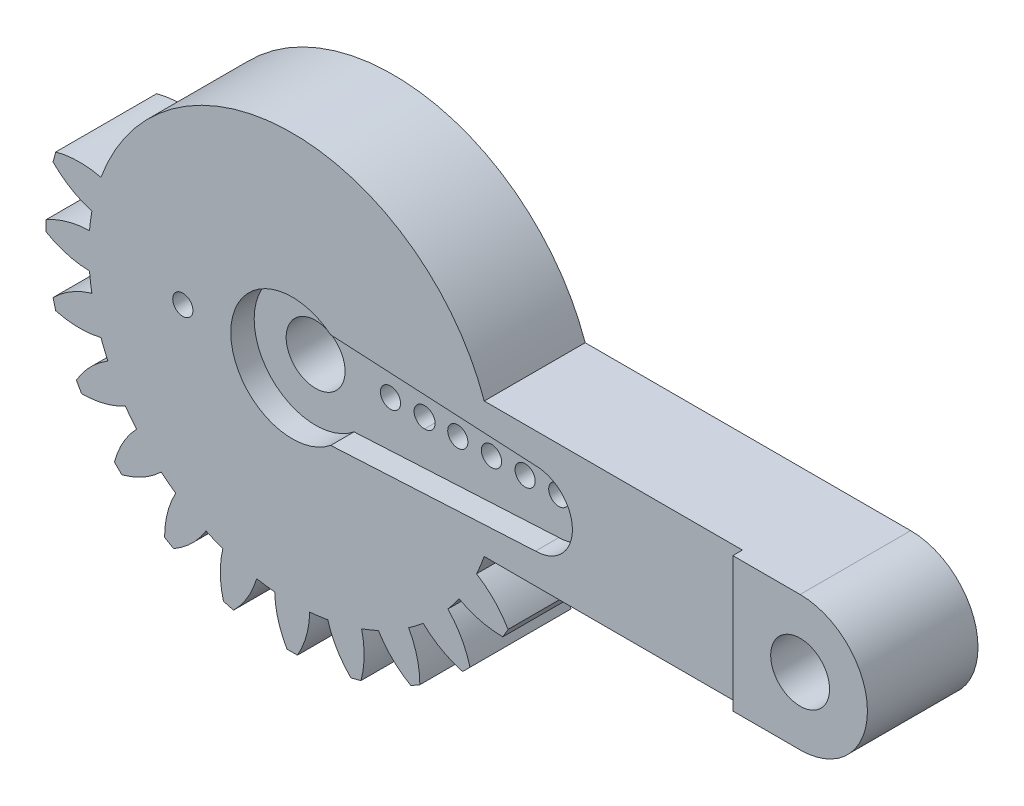
from build123d import *

# Parameters (mm, degrees)
SKETCH2_R           = 1.75
BOSS_EXTRUDE1_DEPTH = 10
SKETCH10_R          = 0.6
CUT_EXTRUDE1_DEPTH  = 40.007683858
CUT_EXTRUDE3_START  = -4
CUT_EXTRUDE3_DEPTH  = 4
BOSS_EXTRUDE2_START = 0.25
BOSS_EXTRUDE2_DEPTH = 0.25
SKETCH13_R          = 1.75
CUT_EXTRUDE11_DEPTH = 39.178520139
SKETCH28_R          = 0.6
CUT_EXTRUDE12_DEPTH = 39.178520139
CUT_EXTRUDE14_DEPTH = 1.39
BOSS_EXTRUDE3_START = 0.32
BOSS_EXTRUDE3_DEPTH = 0.32
SKETCH32_R          = 1.75
CUT_EXTRUDE18_DEPTH = 39.272239286


with BuildPart() as part:
    # Sketch2 → Boss-Extrude1 (new body)
    with BuildSketch(Plane.XY):
        with BuildLine():
            ThreePointArc((-11.365584201, 4.122086336), (-12.71070456, 4.273667417), (-14.051260935, 4.085959636))
            Line((-14.051260935, 4.085959636), (-14.211728743, 3.487085624))
            ThreePointArc((-14.211728743, 3.487085624), (-13.144626757, 2.65424773), (-11.903927815, 2.112960617))
            ThreePointArc((-11.903927815, 2.112960617), (-11.986568374, 1.578061664), (-12.04518576, 1.04))
            ThreePointArc((-12.04518576, 1.04), (-13.383704325, 0.838273314), (-14.63, 0.31))
            Line((-14.63, 0.31), (-14.63, -0.31))
            ThreePointArc((-14.63, -0.31), (-13.383704325, -0.838273314), (-12.04518576, -1.04))
            ThreePointArc((-12.04518576, -1.04), (-11.986568374, -1.578061664), (-11.903927815, -2.112960617))
            ThreePointArc((-11.903927815, -2.112960617), (-13.144626757, -2.65424773), (-14.211728743, -3.487085624))
            Line((-14.211728743, -3.487085624), (-14.051260935, -4.085959636))
            ThreePointArc((-14.051260935, -4.085959636), (-12.71070456, -4.273667417), (-11.365584201, -4.122086336))
            ThreePointArc((-11.365584201, -4.122086336), (-11.169703548, -4.626642697), (-10.951436862, -5.12192646))
            ThreePointArc((-10.951436862, -5.12192646), (-12.009764599, -5.965886177), (-12.824951657, -7.046532125))
            Line((-12.824951657, -7.046532125), (-12.514951657, -7.583467875))
            ThreePointArc((-12.514951657, -7.583467875), (-11.171491285, -7.417818147), (-9.911436862, -6.9232593))
            ThreePointArc((-9.911436862, -6.9232593), (-9.591641884, -7.359925677), (-9.252623584, -7.781841479))
            ThreePointArc((-9.252623584, -7.781841479), (-10.05645683, -8.870959341), (-10.564175311, -10.125769107))
            Line((-10.564175311, -10.125769107), (-10.125769107, -10.564175311))
            ThreePointArc((-10.125769107, -10.564175311), (-8.870959341, -10.05645683), (-7.781841479, -9.252623584))
            ThreePointArc((-7.781841479, -9.252623584), (-7.359925677, -9.591641884), (-6.9232593, -9.911436862))
            ThreePointArc((-6.9232593, -9.911436862), (-7.417818147, -11.171491285), (-7.583467875, -12.514951657))
            Line((-7.583467875, -12.514951657), (-7.046532125, -12.824951657))
            ThreePointArc((-7.046532125, -12.824951657), (-5.965886177, -12.009764599), (-5.12192646, -10.951436862))
            ThreePointArc((-5.12192646, -10.951436862), (-4.626642697, -11.169703548), (-4.122086336, -11.365584201))
            ThreePointArc((-4.122086336, -11.365584201), (-4.273667417, -12.71070456), (-4.085959636, -14.051260935))
            Line((-4.085959636, -14.051260935), (-3.487085624, -14.211728743))
            ThreePointArc((-3.487085624, -14.211728743), (-2.65424773, -13.144626757), (-2.112960617, -11.903927815))
            ThreePointArc((-2.112960617, -11.903927815), (-1.578061664, -11.986568374), (-1.04, -12.04518576))
            ThreePointArc((-1.04, -12.04518576), (-0.838273314, -13.383704325), (-0.31, -14.63))
            Line((-0.31, -14.63), (0.31, -14.63))
            ThreePointArc((0.31, -14.63), (0.838273314, -13.383704325), (1.04, -12.04518576))
            ThreePointArc((1.04, -12.04518576), (1.578061664, -11.986568374), (2.112960617, -11.903927815))
            ThreePointArc((2.112960617, -11.903927815), (2.65424773, -13.144626757), (3.487085624, -14.211728743))
            Line((3.487085624, -14.211728743), (4.085959636, -14.051260935))
            ThreePointArc((4.085959636, -14.051260935), (4.273667417, -12.71070456), (4.122086336, -11.365584201))
            ThreePointArc((4.122086336, -11.365584201), (4.626642697, -11.169703548), (5.12192646, -10.951436862))
            ThreePointArc((5.12192646, -10.951436862), (5.965886177, -12.009764599), (7.046532125, -12.824951657))
            Line((7.046532125, -12.824951657), (7.583467875, -12.514951657))
            ThreePointArc((7.583467875, -12.514951657), (7.417818147, -11.171491285), (6.9232593, -9.911436862))
            ThreePointArc((6.9232593, -9.911436862), (7.359925677, -9.591641884), (7.781841479, -9.252623584))
            ThreePointArc((7.781841479, -9.252623584), (8.870959341, -10.05645683), (10.125769107, -10.564175311))
            Line((10.125769107, -10.564175311), (10.564175311, -10.125769107))
            ThreePointArc((10.564175311, -10.125769107), (10.05645683, -8.870959341), (9.252623584, -7.781841479))
            ThreePointArc((9.252623584, -7.781841479), (9.591641884, -7.359925677), (9.911436862, -6.9232593))
            ThreePointArc((9.911436862, -6.9232593), (11.171491285, -7.417818147), (12.514951657, -7.583467875))
            Line((12.514951657, -7.583467875), (12.824951657, -7.046532125))
            ThreePointArc((12.824951657, -7.046532125), (12.009764599, -5.965886177), (10.951436862, -5.12192646))
            ThreePointArc((10.951436862, -5.12192646), (11.194344337, -4.566700654), (11.409123542, -4))
            Line((11.409123542, -4), (30.75, -4))
            ThreePointArc((30.75, -4), (34.75, 0), (30.75, 4))
            Line((30.75, 4), (11.409123542, 4))
            ThreePointArc((11.409123542, 4), (0.064808849, 12.089826294), (-11.365584201, 4.122086336))
        make_face()
        Circle(SKETCH2_R, mode=Mode.SUBTRACT)
        with Locations((30.75, 0)):
            Circle(SKETCH2_R, mode=Mode.SUBTRACT)
    extrude(amount=-BOSS_EXTRUDE1_DEPTH)

    # Sketch10 → Cut-Extrude1 (cut, through all)
    with BuildSketch(Plane(origin=(0, 0, -10), x_dir=(-1, 0, 0), z_dir=(0, 0, -1))):
        with Locations((6.5, 0)):
            Circle(SKETCH10_R)
        with Locations((-6.5, 0)):
            Circle(SKETCH10_R)
    extrude(amount=-CUT_EXTRUDE1_DEPTH, mode=Mode.SUBTRACT)

    # Sketch14 → Cut-Extrude3 (cut)
    with BuildSketch(Plane(origin=(0, 0, -10), x_dir=(-1, 0, 0), z_dir=(0, 0, -1)).offset(CUT_EXTRUDE3_START)):
        with BuildLine():
            Line((-11.409123542, 4), (-30.75, 4))
            ThreePointArc((-30.75, 4), (-34.75, 0), (-30.75, -4))
            Line((-30.75, -4), (-11.409123542, -4))
            ThreePointArc((-11.409123542, -4), (-11.194344337, -4.566700654), (-10.951436862, -5.12192646))
            ThreePointArc((-10.951436862, -5.12192646), (-12.009764599, -5.965886177), (-12.824951657, -7.046532125))
            Line((-12.824951657, -7.046532125), (-12.514951657, -7.583467875))
            ThreePointArc((-12.514951657, -7.583467875), (-11.171491285, -7.417818147), (-9.911436862, -6.9232593))
            ThreePointArc((-9.911436862, -6.9232593), (-9.591641884, -7.359925677), (-9.252623584, -7.781841479))
            ThreePointArc((-9.252623584, -7.781841479), (-10.05645683, -8.870959341), (-10.564175311, -10.125769107))
            Line((-10.564175311, -10.125769107), (-10.125769107, -10.564175311))
            ThreePointArc((-10.125769107, -10.564175311), (-8.870959341, -10.05645683), (-7.781841479, -9.252623584))
            ThreePointArc((-7.781841479, -9.252623584), (-7.359925677, -9.591641884), (-6.9232593, -9.911436862))
            ThreePointArc((-6.9232593, -9.911436862), (-7.417818147, -11.171491285), (-7.583467875, -12.514951657))
            Line((-7.583467875, -12.514951657), (-7.046532125, -12.824951657))
            ThreePointArc((-7.046532125, -12.824951657), (-5.965886177, -12.009764599), (-5.12192646, -10.951436862))
            ThreePointArc((-5.12192646, -10.951436862), (-4.626642697, -11.169703548), (-4.122086336, -11.365584201))
            ThreePointArc((-4.122086336, -11.365584201), (-4.273667417, -12.71070456), (-4.085959636, -14.051260935))
            Line((-4.085959636, -14.051260935), (-3.487085624, -14.211728743))
            ThreePointArc((-3.487085624, -14.211728743), (-2.65424773, -13.144626757), (-2.112960617, -11.903927815))
            ThreePointArc((-2.112960617, -11.903927815), (-1.578061664, -11.986568374), (-1.04, -12.04518576))
            ThreePointArc((-1.04, -12.04518576), (-0.838273314, -13.383704325), (-0.31, -14.63))
            Line((-0.31, -14.63), (0.31, -14.63))
            ThreePointArc((0.31, -14.63), (0.838273314, -13.383704325), (1.04, -12.04518576))
            ThreePointArc((1.04, -12.04518576), (1.578061664, -11.986568374), (2.112960617, -11.903927815))
            ThreePointArc((2.112960617, -11.903927815), (2.65424773, -13.144626757), (3.487085624, -14.211728743))
            Line((3.487085624, -14.211728743), (4.085959636, -14.051260935))
            ThreePointArc((4.085959636, -14.051260935), (4.273667417, -12.71070456), (4.122086336, -11.365584201))
            ThreePointArc((4.122086336, -11.365584201), (4.626642697, -11.169703548), (5.12192646, -10.951436862))
            ThreePointArc((5.12192646, -10.951436862), (5.965886177, -12.009764599), (7.046532125, -12.824951657))
            Line((7.046532125, -12.824951657), (7.583467875, -12.514951657))
            ThreePointArc((7.583467875, -12.514951657), (7.417818147, -11.171491285), (6.9232593, -9.911436862))
            ThreePointArc((6.9232593, -9.911436862), (7.359925677, -9.591641884), (7.781841479, -9.252623584))
            ThreePointArc((7.781841479, -9.252623584), (8.870959341, -10.05645683), (10.125769107, -10.564175311))
            Line((10.125769107, -10.564175311), (10.564175311, -10.125769107))
            ThreePointArc((10.564175311, -10.125769107), (10.05645683, -8.870959341), (9.252623584, -7.781841479))
            ThreePointArc((9.252623584, -7.781841479), (9.591641884, -7.359925677), (9.911436862, -6.9232593))
            ThreePointArc((9.911436862, -6.9232593), (11.171491285, -7.417818147), (12.514951657, -7.583467875))
            Line((12.514951657, -7.583467875), (12.824951657, -7.046532125))
            ThreePointArc((12.824951657, -7.046532125), (12.009764599, -5.965886177), (10.951436862, -5.12192646))
            ThreePointArc((10.951436862, -5.12192646), (11.169703548, -4.626642697), (11.365584201, -4.122086336))
            ThreePointArc((11.365584201, -4.122086336), (12.71070456, -4.273667417), (14.051260935, -4.085959636))
            Line((14.051260935, -4.085959636), (14.211728743, -3.487085624))
            ThreePointArc((14.211728743, -3.487085624), (13.144626757, -2.65424773), (11.903927815, -2.112960617))
            ThreePointArc((11.903927815, -2.112960617), (11.986568374, -1.578061664), (12.04518576, -1.04))
            ThreePointArc((12.04518576, -1.04), (13.383704325, -0.838273314), (14.63, -0.31))
            Line((14.63, -0.31), (14.63, 0.31))
            ThreePointArc((14.63, 0.31), (13.383704325, 0.838273314), (12.04518576, 1.04))
            ThreePointArc((12.04518576, 1.04), (11.986568374, 1.578061664), (11.903927815, 2.112960617))
            ThreePointArc((11.903927815, 2.112960617), (13.144626757, 2.65424773), (14.211728743, 3.487085624))
            Line((14.211728743, 3.487085624), (14.051260935, 4.085959636))
            ThreePointArc((14.051260935, 4.085959636), (12.71070456, 4.273667417), (11.365584201, 4.122086336))
            ThreePointArc((11.365584201, 4.122086336), (-0.064808849, 12.089826294), (-11.409123542, 4))
        make_face()
    extrude(amount=CUT_EXTRUDE3_DEPTH, mode=Mode.SUBTRACT)

    # Sketch26 → Boss-Extrude2 (add)
    with BuildSketch(Plane.XY.offset(BOSS_EXTRUDE2_START)):
        with BuildLine():
            Line((30.75, 4), (26.75, 4))
            Line((26.75, 4), (26.75, -4))
            Line((26.75, -4), (30.75, -4))
            ThreePointArc((30.75, -4), (34.75, 0), (30.75, 4))
        make_face()
    extrude(amount=-BOSS_EXTRUDE2_DEPTH)

    # Sketch13 → Cut-Extrude11 (cut, through all)
    with BuildSketch(Plane.XY):
        with Locations((30.75, 0)):
            Circle(SKETCH13_R)
    extrude(amount=CUT_EXTRUDE11_DEPTH, mode=Mode.SUBTRACT)

    # Sketch28 → Cut-Extrude12 (cut, through all)
    with BuildSketch(Plane.XY):
        with Locations((14.45, 0)):
            Circle(SKETCH28_R)
        with Locations((12.45, 0)):
            Circle(SKETCH28_R)
        with Locations((10.45, 0)):
            Circle(SKETCH28_R)
        with Locations((8.45, 0)):
            Circle(SKETCH28_R)
        with Locations((6.45, 0)):
            Circle(SKETCH28_R)
        with Locations((4.45, 0)):
            Circle(SKETCH28_R)
    extrude(amount=-CUT_EXTRUDE12_DEPTH, mode=Mode.SUBTRACT)

    # Sketch29 → Cut-Extrude14 (cut)
    with BuildSketch(Plane.XY):
        with BuildLine():
            Line((14.45542659, 2.199993307), (2.285992653, 2.845476689))
            ThreePointArc((2.285992653, 2.845476689), (-3.65, 0), (2.285992653, -2.845476689))
            Line((2.285992653, -2.845476689), (14.45542659, -2.199993307))
            ThreePointArc((14.45542659, -2.199993307), (16.65, 0), (14.45542659, 2.199993307))
        make_face()
    extrude(amount=-CUT_EXTRUDE14_DEPTH, mode=Mode.SUBTRACT)

    # Sketch31 → Boss-Extrude3 (add)
    with BuildSketch(Plane.XY.offset(0.25).offset(BOSS_EXTRUDE3_START)):
        with BuildLine():
            Line((26.75, -4), (30.75, -4))
            ThreePointArc((30.75, -4), (34.75, 0), (30.75, 4))
            Line((30.75, 4), (26.75, 4))
            Line((26.75, 4), (26.75, -4))
        make_face()
    extrude(amount=-BOSS_EXTRUDE3_DEPTH)

    # Sketch32 → Cut-Extrude18 (cut, through all)
    with BuildSketch(Plane(origin=(0, 0, -6), x_dir=(-1, 0, 0), z_dir=(0, 0, -1))):
        with Locations((-30.75, 0)):
            Circle(SKETCH32_R)
    extrude(amount=-CUT_EXTRUDE18_DEPTH, mode=Mode.SUBTRACT)


solid = part.part
